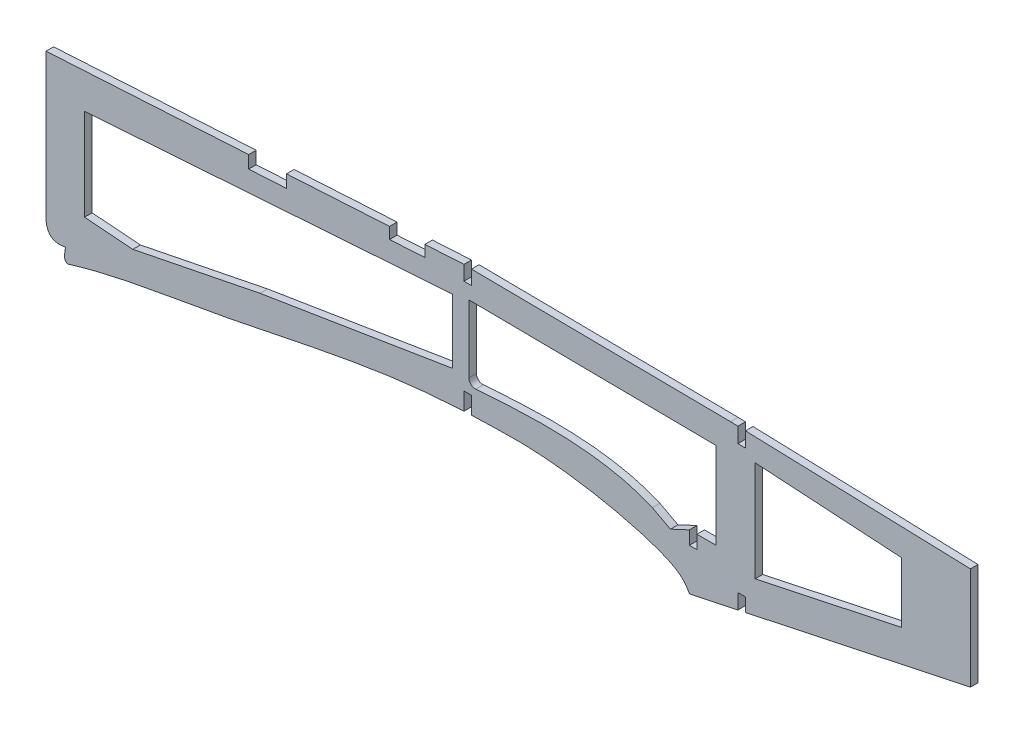
from build123d import *

# Parameters (mm, degrees)
BOSS_EXTRUDE2_DEPTH = 3


with BuildPart() as part:
    # Sketch6 → Boss-Extrude2 (new body)
    with BuildSketch(Plane(origin=(0, 0, -3), x_dir=(-1, 0, 0), z_dir=(0, 0, -1))):
        with BuildLine():
            Line((-19.25, 3.741713812), (0, -0.35))
            add(Edge.make_bspline(
                [(0, -0.35), (3.178862469, 6.495343287), (8.987756305, 8.032168144), (22.140633739, 13.071207305), (43.250433247, 17.69324185), (66.39602757, 18.219905629)],
                knots=[0, 0, 0, 0, 0, 0, 1, 1, 1, 1, 1, 1], degree=5))
            add(Edge.make_bspline(
                [(66.39602757, 18.219905629), (73.079858249, 18.217137873), (79.768873399, 18.101745103), (86.45, 17.815976098)],
                knots=[0.875945967, 0.875945967, 0.875945967, 0.875945967, 0.985673704, 0.985673704, 0.985673704, 0.985673704], degree=3))
            Line((86.45, 17.815976098), (86.45, 24.670250599))
            Line((86.45, 24.670250599), (89.45, 24.670250599))
            Line((89.45, 24.670250599), (89.45, 17.675984992))
            add(Edge.make_bspline(
                [(89.45, 17.675984992), (90.320899947, 17.631898595), (91.191632468, 17.584767892), (92.062168571, 17.534464817)],
                knots=[1.002100386, 1.002100386, 1.002100386, 1.002100386, 1.01640933, 1.01640933, 1.01640933, 1.01640933], degree=3))
            add(Edge.make_bspline(
                [(92.062168571, 17.534464817), (95.665977641, 17.334138157), (108.464938821, 16.428798519), (140.620964858, 12.117510077), (188.11962528, 1.017487261), (227.440155367, -4.385412225), (246.547152618, -10.292650589)],
                knots=[0, 0, 0, 0, 0.05922822, 0.210539222, 0.531730365, 0.859536637, 0.859536637, 0.859536637, 0.859536637], degree=3))
            add(Edge.make_bspline(
                [(246.547152618, -10.292650589), (248.808777451, -9.863624592), (247.588252624, -6.363600679), (247.543685046, -4.960441529)],
                knots=[0, 0, 0, 0, 1, 1, 1, 1], degree=3))
            add(Edge.make_bspline(
                [(247.543685046, -4.960441529), (248.441640739, -5.14429555), (249.235236144, -5.197240659)],
                knots=[0, 0, 0, 0.116478493, 0.116478493, 0.116478493], degree=2))
            add(Edge.make_bspline(
                [(249.235236144, -5.197240659), (255.254876243, -5.598843915), (255.27, 1.531581744)],
                knots=[0.116478493, 0.116478493, 0.116478493, 1, 1, 1], degree=2))
            Line((255.27, 1.531581744), (255.27, 58.507349411))
            Line((255.27, 58.507349411), (174.85, 63.193699149))
            Line((174.85, 63.193699149), (174.85, 58.185216861))
            Line((174.85, 58.185216861), (159.85, 59.059318403))
            Line((159.85, 59.059318403), (159.85, 64.067800692))
            Line((159.85, 64.067800692), (118.95, 66.451184232))
            Line((118.95, 66.451184232), (118.95, 61.943550172))
            Line((118.95, 61.943550172), (104.95, 62.759378279))
            Line((104.95, 62.759378279), (104.95, 67.267012338))
            Line((104.95, 67.267012338), (89.45, 68.170250599))
            Line((89.45, 68.170250599), (89.45, 62.370250599))
            Line((89.45, 62.370250599), (86.45, 62.370250599))
            Line((86.45, 62.370250599), (86.45, 68.043292799))
            Line((86.45, 68.043292799), (-16.333378442, 66.994986377))
            Line((-16.333378442, 66.994986377), (-19.25, 66.904044127))
            Line((-19.25, 66.904044127), (-19.25, 60.904044127))
            Line((-19.25, 60.904044127), (-22.25, 60.904044127))
            Line((-22.25, 60.904044127), (-22.25, 66.810502081))
            Line((-22.25, 66.810502081), (-111.531056313, 64.026657849))
            Line((-111.531056313, 64.026657849), (-111.531056313, 23.356657849))
            Line((-111.531056313, 23.356657849), (-22.25, 4.379383497))
            Line((-22.25, 4.379383497), (-22.25, 9.741713812))
            Line((-22.25, 9.741713812), (-19.25, 9.741713812))
            Line((-19.25, 9.741713812), (-19.25, 3.741713812))
        make_face()
        Polygon((-84.1, 54.203030213), (-26.1, 57.75847956), (-26.1, 17.874749636), (-84.1, 30.203030213), align=None, mode=Mode.SUBTRACT)
        with BuildLine():
            Line((-10.5, 21.65), (-10.5, 55.95))
            Line((-10.5, 55.95), (87.47, 56.949213898))
            Line((87.47, 56.949213898), (87.47, 30.129694509))
            ThreePointArc((87.47, 30.129694509), (86.67270256, 28.299174366), (84.789356805, 27.636229443))
            add(Edge.make_bspline(
                [(14.701665666, 21.959575817), (21.19900444, 24.808951329), (34.471850374, 27.925627057), (54.295468051, 29.219545771), (70.832055402, 28.62299092), (81.026620283, 27.908827105), (84.789356805, 27.636229443)],
                knots=[0.099500985, 0.099500985, 0.099500985, 0.099500985, 0.360279093, 0.592189537, 0.828480504, 0.96707438, 0.96707438, 0.96707438, 0.96707438], degree=3))
            Line((14.701665666, 21.959575817), (7.522354632, 18.142268428))
            Line((7.522354632, 18.142268428), (0, 21.65))
            Line((0, 21.65), (0, 16.35))
            Line((0, 16.35), (-3, 16.35))
            Line((-3, 16.35), (-3, 21.65))
            Line((-3, 21.65), (-10.5, 21.65))
        make_face(mode=Mode.SUBTRACT)
        Polygon((93.97, 30.170250599), (93.97, 55.670250599), (239.97, 45.483901662), (239.97, 9.104044127), (220.823057098, 7.643571), (170.32923345, 17.7710139), align=None, mode=Mode.SUBTRACT)
    extrude(amount=BOSS_EXTRUDE2_DEPTH)


solid = part.part
